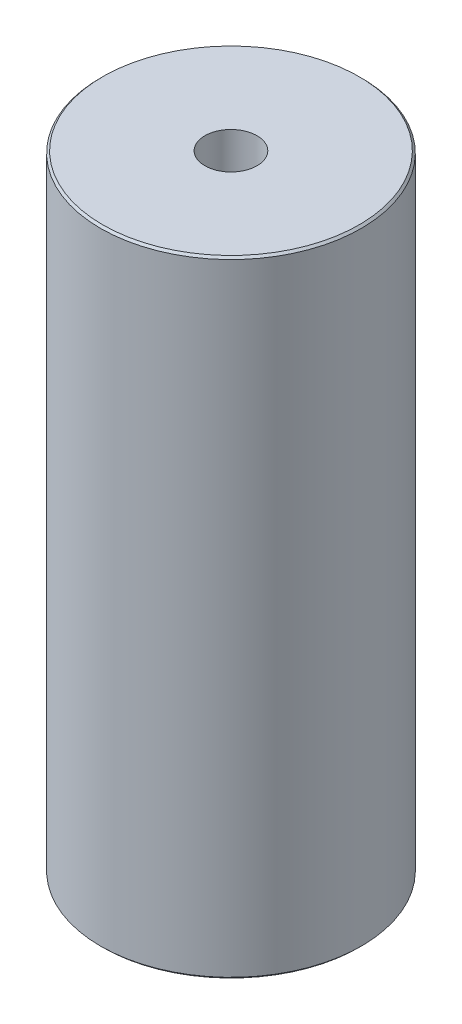
from build123d import *

# Parameters (mm, degrees)
SKETCH_1_R             = 12.5
EXTRUDE_1_DEPTH        = 60
HOLE_WIZARD_M6_1_D     = 5
HOLE_WIZARD_M6_1_DEPTH = 15
HOLE_WIZARD_M6_1_TIP   = 1.502151548
CHAMFER_1_SIZE         = 0.2


with BuildPart() as part:
    # 草图1 → 凸台-拉伸1 (new body)
    with BuildSketch(Plane(origin=(0, 0, 0), x_dir=(1, 0, 0), z_dir=(0, 1, 0))):
        with Locations(Location((0, 0, 0), (0, 0, 270))):
            Circle(SKETCH_1_R)
    extrude(amount=EXTRUDE_1_DEPTH)

    # M6 螺纹孔1
    with Locations(Plane(origin=(0, 60, 0), x_dir=(1, 0, 0), z_dir=(0, 1, 0))):
        with Locations((0, 0)):
            Hole(HOLE_WIZARD_M6_1_D / 2, depth=HOLE_WIZARD_M6_1_DEPTH)
            with Locations((0, 0, -(HOLE_WIZARD_M6_1_DEPTH + HOLE_WIZARD_M6_1_TIP / 2))):  # 118° drill point
                Cone(0, HOLE_WIZARD_M6_1_D / 2, HOLE_WIZARD_M6_1_TIP, mode=Mode.SUBTRACT)

    # 倒角1
    chamfer_1_edges = [part.edges().sort_by_distance(p)[0] for p in [
        (0, 0, -12.5),
        (0, 60, -12.5),
    ]]
    chamfer(chamfer_1_edges, length=CHAMFER_1_SIZE)


solid = part.part
